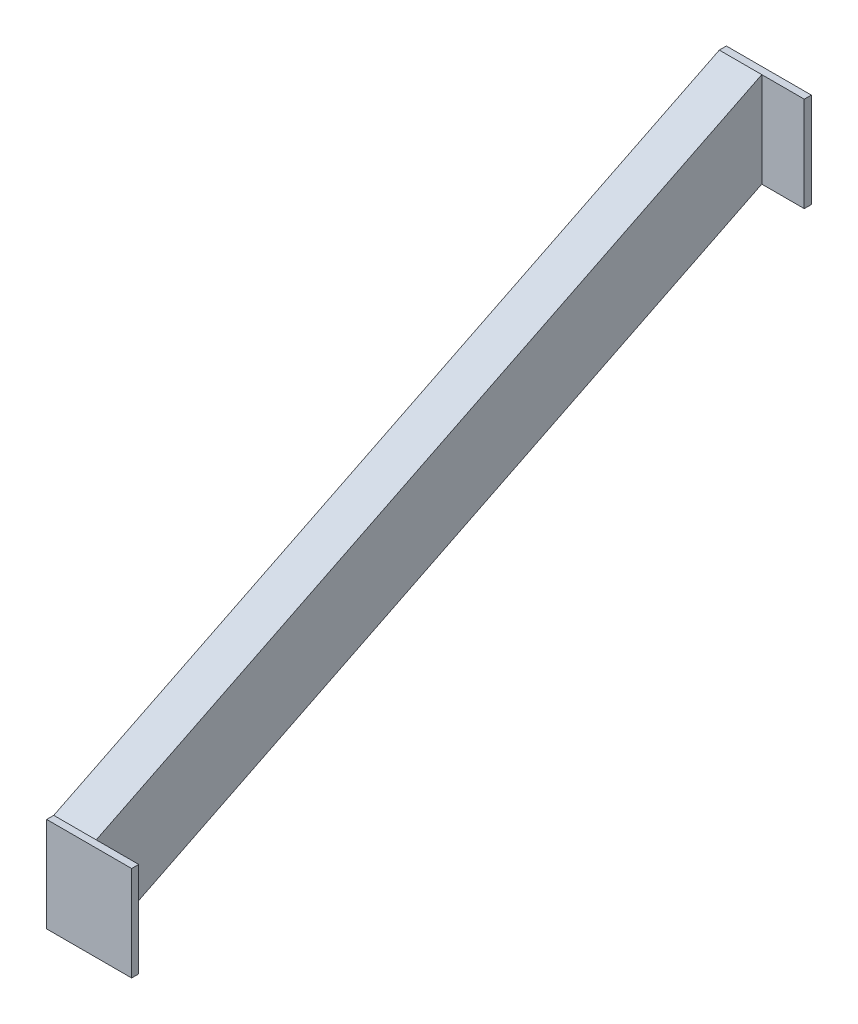
from build123d import *

# Parameters (mm, degrees)
BOSS_EXTRUDE1_DEPTH = 76.2
SKETCH5_W           = 152.4
SKETCH5_H           = 170.103674112
BOSS_EXTRUDE3_DEPTH = 12.7
SKETCH6_W           = 152.4
SKETCH6_H           = 170.103674112
BOSS_EXTRUDE4_DEPTH = 12.7


with BuildPart() as part:
    # Sketch2 → Boss-Extrude1 (new body)
    with BuildSketch(Plane(origin=(0, 0, 0), x_dir=(0, 0, -1), z_dir=(1, 0, 0))):
        Polygon((0, 0), (0, 170.103674112), (1193.8, 762), (1193.8, 591.896325888), align=None)
    extrude(amount=BOSS_EXTRUDE1_DEPTH)

    # Sketch5 → Boss-Extrude3 (add)
    with BuildSketch(Plane(origin=(0, 0, -1193.8), x_dir=(-1, 0, 0), z_dir=(0, 0, -1))):
        with Locations((-76.2, 676.948162944)):
            Rectangle(SKETCH5_W, SKETCH5_H)
    extrude(amount=BOSS_EXTRUDE3_DEPTH)

    # Sketch6 → Boss-Extrude4 (add)
    with BuildSketch(Plane.XY):
        with Locations((76.2, 85.051837056)):
            Rectangle(SKETCH6_W, SKETCH6_H)
    extrude(amount=BOSS_EXTRUDE4_DEPTH)


solid = part.part
